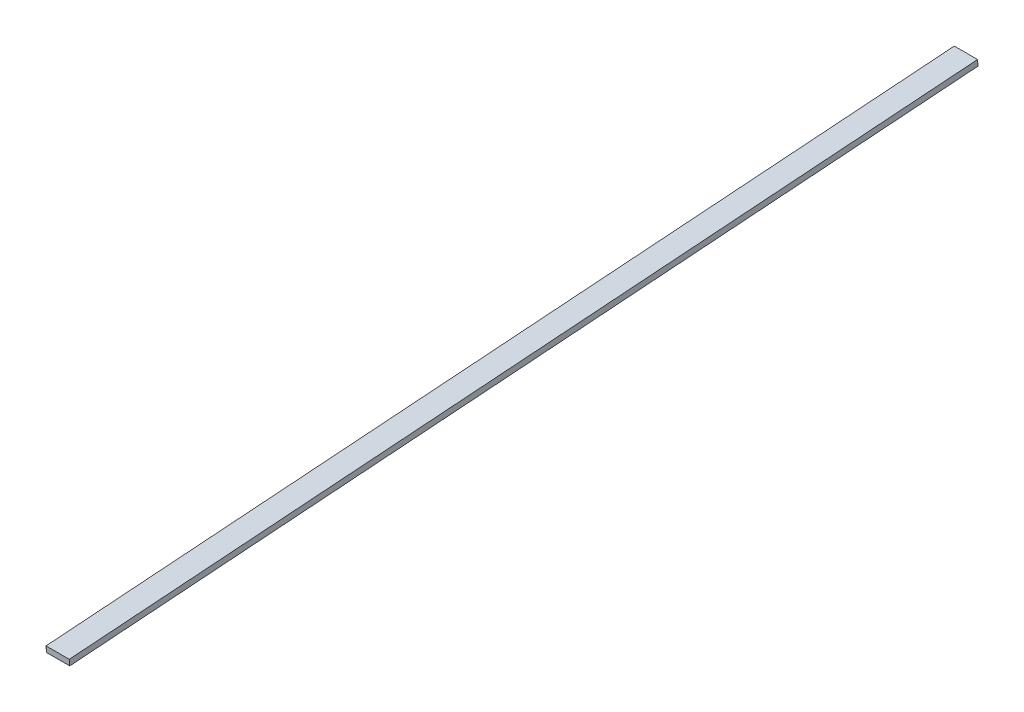
from build123d import *

# Parameters (mm, degrees)
BOSS_EXTRUDE1_DEPTH = 18.542


with BuildPart() as part:
    # Sketch3 → Boss-Extrude1 (new body)
    with BuildSketch(Plane(origin=(238.509206631, 0, 0), x_dir=(0, 0, -1), z_dir=(1, 0, 0))):
        Polygon((-1497.606194078, 367.994441226), (-1500.781194078, 367.76617666), (-1501.122709453, 372.51641597), (-777.222709453, 424.560737079), (-776.881194078, 419.810497769), (-780.056194078, 419.582233203), align=None)
    extrude(amount=BOSS_EXTRUDE1_DEPTH)


solid = part.part
